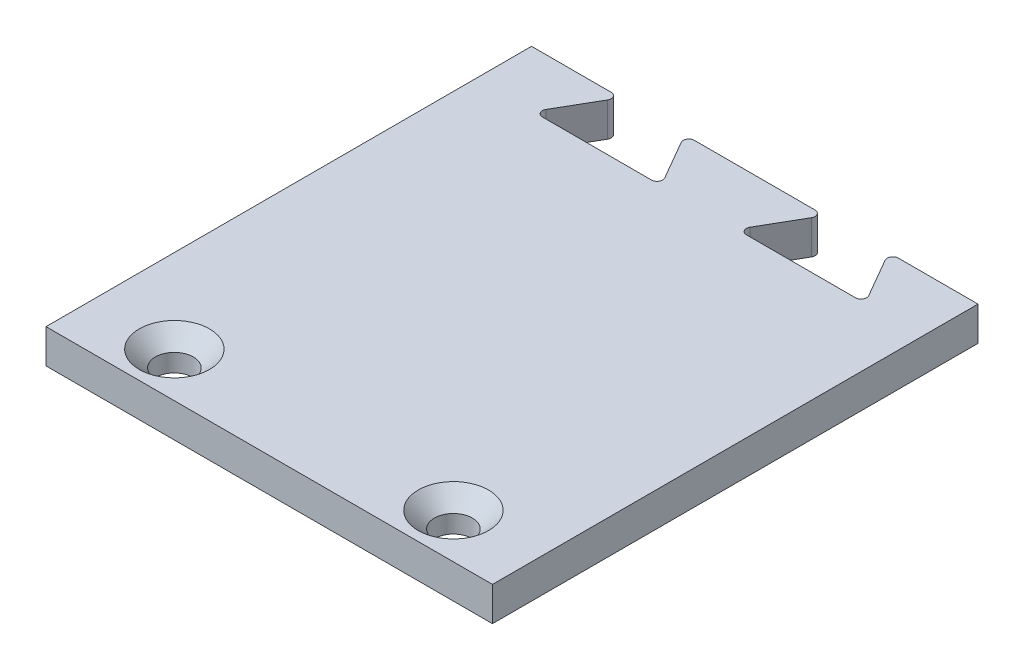
from build123d import *

# Parameters (mm, degrees)
BOSS_EXTRUDE1_DEPTH                            = 3.05
FILLET3_R                                      = 0.5
CSK_FOR_M3_FLAT_HEAD_MACHINE_SCREW1_AT_2_COUNT = 2
CSK_FOR_M3_FLAT_HEAD_MACHINE_SCREW1_AT_2_PITCH = 25


with BuildPart() as part:
    # Sketch1 → Boss-Extrude1 (new body)
    with BuildSketch(Plane(origin=(0, 0, 0), x_dir=(1, 0, 0), z_dir=(0, 1, 0))):
        Polygon((0, 0), (0, 43.5), (8, 43.5), (5.113248654, 38.5), (16.613248654, 38.5), (13.726497308, 43.5), (26.273502692, 43.5), (23.386751346, 38.5), (34.886751346, 38.5), (32, 43.5), (40, 43.5), (40, 0), align=None)
    extrude(amount=BOSS_EXTRUDE1_DEPTH)

    # Fillet3
    fillet3_edges = [part.edges().sort_by_distance(p)[0] for p in [
        (8, 1.525, -43.5),
        (5.113248654, 1.525, -38.5),
        (16.613248654, 1.525, -38.5),
        (13.726497308, 1.525, -43.5),
        (26.273502692, 1.525, -43.5),
        (23.386751346, 1.525, -38.5),
        (34.886751346, 1.525, -38.5),
        (32, 1.525, -43.5),
    ]]
    fillet(fillet3_edges, radius=FILLET3_R)

    # Sketch7 → CSK for M3 Flat Head Machine Screw1 (revolve, cut)
    with BuildSketch(Plane(origin=(7.5, 3.05, -4), x_dir=(0, 0, 1), z_dir=(1, 0, 0))):
        Polygon((0, 0), (0, 3.05), (1.7, 3.05), (1.7, 1.45), (3.15, 0), align=None)
    csk_for_m3_flat_head_machine_screw1 = revolve(axis=Axis((7.5, 9.4, -4), (0, -1, 0)), mode=Mode.SUBTRACT)

    # CSK for M3 Flat Head Machine Screw1 at 2: CSK for M3 Flat Head Machine Screw1 ×2
    with Locations(*[(i * CSK_FOR_M3_FLAT_HEAD_MACHINE_SCREW1_AT_2_PITCH, 0, 0) for i in range(1, CSK_FOR_M3_FLAT_HEAD_MACHINE_SCREW1_AT_2_COUNT)]):
        add(csk_for_m3_flat_head_machine_screw1, mode=Mode.SUBTRACT)


solid = part.part
